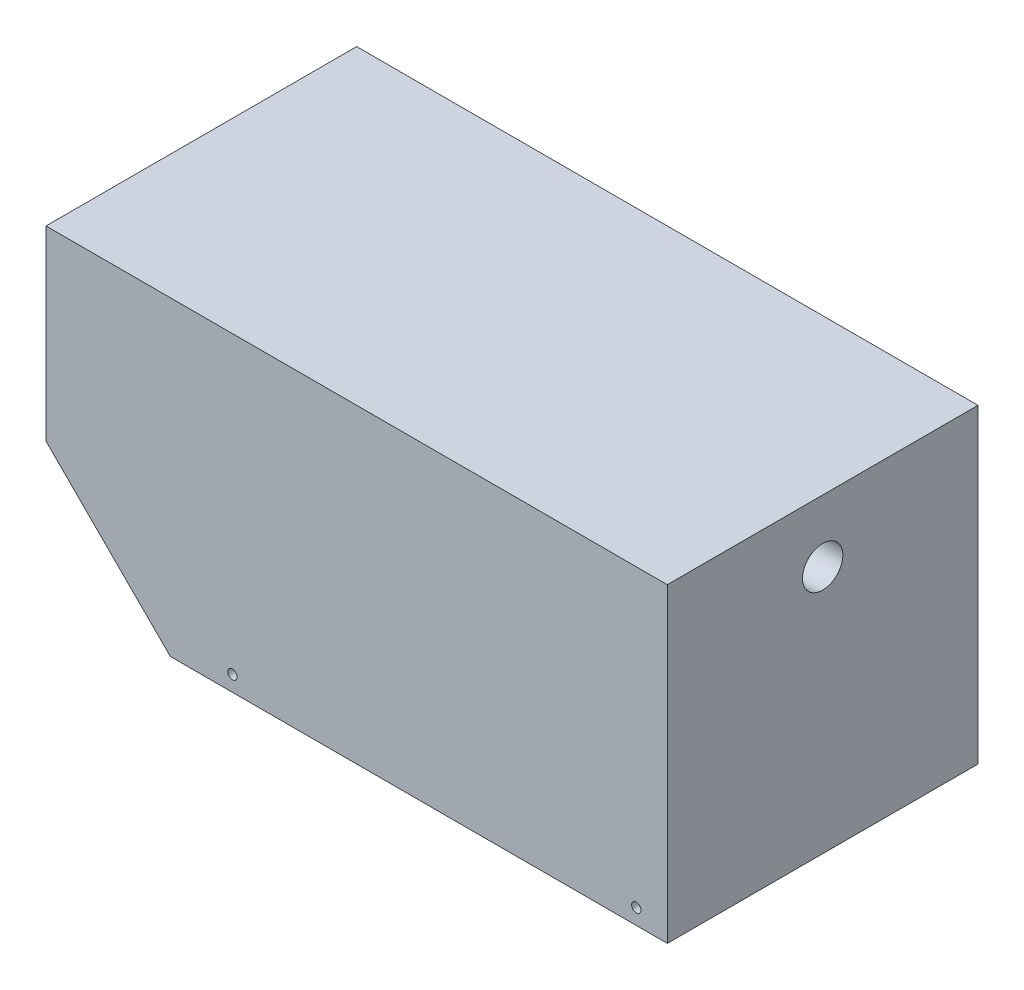
from build123d import *

# Parameters (mm, degrees)
ESQUISSE1_W             = 200
ESQUISSE1_H             = 100
BOSS_EXTRU_1_DEPTH      = 100
CHANFREIN1_SIZE         = 40
ESQUISSE2_R             = 6.5
ENL_V_MAT_EXTRU_1_DEPTH = 230.128784748
ESQUISSE4_R             = 1.5
ENL_V_MAT_EXTRU_3_DEPTH = 151
ESQUISSE5_W             = 152
ESQUISSE5_H             = 92
ENL_V_MAT_EXTRU_4_DEPTH = 70


with BuildPart() as part:
    # Esquisse1 → Boss.-Extru.1 (new body)
    with BuildSketch(Plane.XY):
        Rectangle(ESQUISSE1_W, ESQUISSE1_H)
    extrude(amount=BOSS_EXTRU_1_DEPTH)

    # Chanfrein1
    chanfrein1_edges = [part.edges().sort_by_distance(p)[0] for p in [
        (-100, -50, 50),
    ]]
    chamfer(chanfrein1_edges, length=CHANFREIN1_SIZE)

    # Esquisse2 → Enlèv. mat.-Extru.1 (cut, through all)
    with BuildSketch(Plane(origin=(100, 0, 0), x_dir=(0, 0, -1), z_dir=(1, 0, 0))):
        with Locations((-50, 30)):
            Circle(ESQUISSE2_R)
    extrude(amount=-ENL_V_MAT_EXTRU_1_DEPTH, mode=Mode.SUBTRACT)

    # Esquisse4 → Enlèv. mat.-Extru.3 (cut, through all)
    with BuildSketch(Plane.XY.offset(100)):
        with Locations((90, -45)):
            Circle(ESQUISSE4_R)
        with Locations((-40, -45)):
            Circle(ESQUISSE4_R)
    extrude(amount=-ENL_V_MAT_EXTRU_3_DEPTH, mode=Mode.SUBTRACT)

    # Esquisse5 → Enlèv. mat.-Extru.4 (cut)
    with BuildSketch(Plane.XZ.offset(50)):
        with Locations((20, 50)):
            Rectangle(ESQUISSE5_W, ESQUISSE5_H)
    extrude(amount=-ENL_V_MAT_EXTRU_4_DEPTH, mode=Mode.SUBTRACT)


solid = part.part
